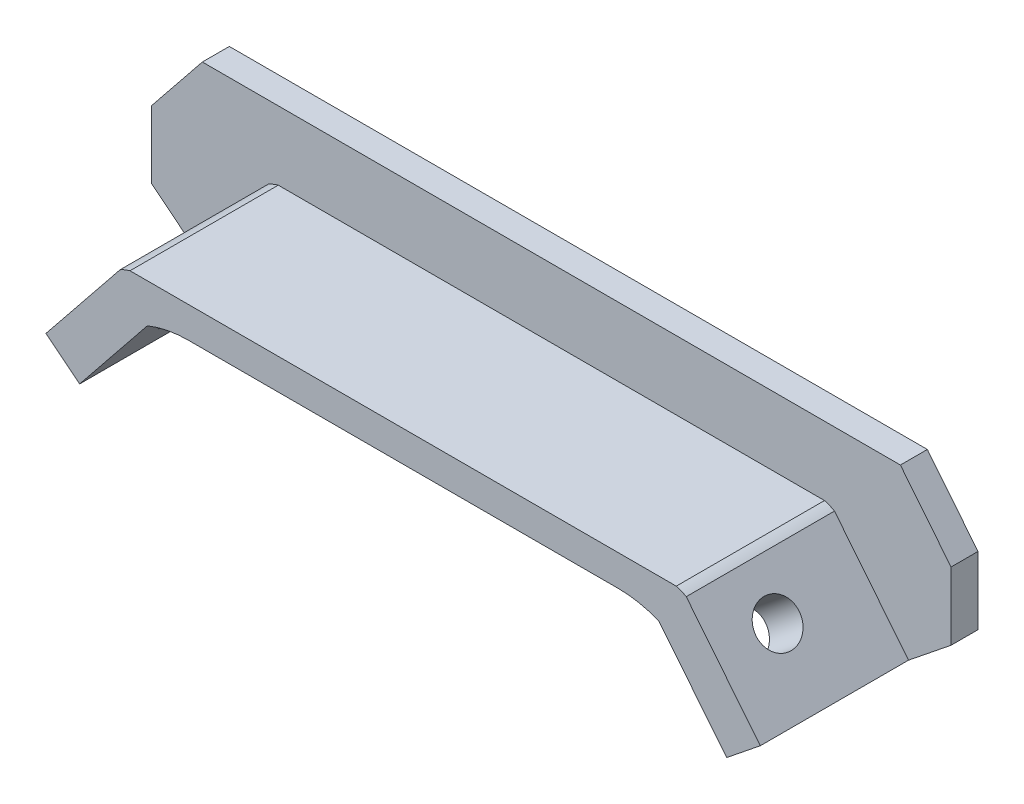
from build123d import *

# Parameters (mm, degrees)
EXTRUDE_5_DEPTH          = 30
EXTRUDE_6_DEPTH          = 2
CUT_EXTRUDE_7_DEPTH      = 10
CUT_EXTRUDE_7_DEPTH_BACK = 10
EXTRUDE_8_DEPTH          = 13
SKETCH_14_R              = 1.6
CUT_EXTRUDE_8_DEPTH      = 10
SKETCH_21_R              = 3.5
CUT_EXTRUDE_10_DEPTH     = 10
FILLET_3_R               = 3
CUT_EXTRUDE_9_DEPTH      = 11
EXTRUDE_7_DEPTH          = 2


with BuildPart() as part:
    # 草图1<3> → 凸台-拉伸5 (new body)
    with BuildSketch(Plane.XY):
        with BuildLine():
            Line((-20.937049459, 94.3), (-26.657578158, 87.182553786))
            Line((-26.657578158, 87.182553786), (-24.786904599, 85.67903111))
            Line((-24.786904599, 85.67903111), (-22.188666929, 88.911742253))
            ThreePointArc((-22.188666929, 88.911742253), (-19.410403975, 91.114358531), (-15.9530884, 91.9))
            Line((-15.9530884, 91.9), (15.9530884, 91.9))
            ThreePointArc((15.9530884, 91.9), (19.410403975, 91.114358531), (22.188666929, 88.911742253))
            Line((22.188666929, 88.911742253), (24.786904599, 85.67903111))
            Line((24.786904599, 85.67903111), (26.657578158, 87.182553786))
            Line((26.657578158, 87.182553786), (20.937049459, 94.3))
            Line((20.937049459, 94.3), (-20.937049459, 94.3))
        make_face()
    extrude(amount=EXTRUDE_5_DEPTH)

    # 草图12 → 凸台-拉伸6 (add)
    with BuildSketch(Plane(origin=(0, 0, 0), x_dir=(-1, 0, 0), z_dir=(0, 0, -1))):
        Polygon((20.937049459, 94.3), (26.657578158, 87.182553786), (26.657578158, 95.163810199), (23.333184583, 99.3), (-23.333184583, 99.3), (-26.657578158, 95.163810199), (-26.657578158, 87.182553786), (-20.937049459, 94.3), align=None)
    extrude(amount=-EXTRUDE_6_DEPTH)

    # 草图13 → 切除-拉伸7 (cut, two sides: drawn at the far end of the back side and taken through both)
    with BuildSketch(Plane.XZ.offset(-91.9).offset(-CUT_EXTRUDE_7_DEPTH_BACK)):
        Polygon((-15.9530884, 13), (15.9530884, 13), (26.657578158, 13), (26.657578158, 30), (-26.657578158, 30), (-26.657578158, 13), align=None)
    extrude(amount=CUT_EXTRUDE_7_DEPTH + CUT_EXTRUDE_7_DEPTH_BACK, mode=Mode.SUBTRACT)

    # 草图20 → 凸台-拉伸8 (add)
    with BuildSketch(Plane.XY.offset(13)):
        Polygon((-24.786904599, 85.67903111), (-19.762367643, 91.930528728), (-18.982920327, 91.304060946), (-24.007457283, 85.052563329), align=None)
    extrude_8 = extrude(amount=-EXTRUDE_8_DEPTH)

    # 草图14 → 切除-拉伸8 (cut, symmetric)
    with BuildSketch(Plane(origin=(-56.116495667, 45.102697556, 0), x_dir=(0, 0, -1), z_dir=(0.7794473160570586, -0.6264677816866944, 0))):
        with Locations(Location((-8.5, 56.385494975, 0), (0, 0, 90))):
            Circle(SKETCH_14_R)
    cut_extrude_8 = extrude(amount=CUT_EXTRUDE_8_DEPTH, both=True, mode=Mode.SUBTRACT)

    # 草图21 → 切除-拉伸10 (cut)
    with BuildSketch(Plane(origin=(-56.116495667, 45.102697556, 0), x_dir=(0, 0, -1), z_dir=(0.7794473160570586, -0.6264677816866944, 0))):
        with Locations((-8.5, 56.385494975)):
            Circle(SKETCH_21_R)
    cut_extrude_10 = extrude(amount=CUT_EXTRUDE_10_DEPTH, mode=Mode.SUBTRACT)

    # 镜向2: 凸台-拉伸8, 切除-拉伸8, 切除-拉伸10 across plane
    add(extrude_8.mirror(Plane(origin=(0, 0, 0), x_dir=(0, 0, 1), z_dir=(1, 0, 0))))
    add(cut_extrude_8.mirror(Plane(origin=(0, 0, 0), x_dir=(0, 0, 1), z_dir=(1, 0, 0))), mode=Mode.SUBTRACT)
    add(cut_extrude_10.mirror(Plane(origin=(0, 0, 0), x_dir=(0, 0, 1), z_dir=(1, 0, 0))), mode=Mode.SUBTRACT)

    # 圆角3
    fillet_3_edges = [part.edges().sort_by_distance(p)[0] for p in [
        (-20.937049459, 94.3, 7.5),
        (20.937049459, 94.3, 7.5),
    ]]
    fillet(fillet_3_edges, radius=FILLET_3_R)

    # 草图15 → 切除-拉伸9 (cut)
    with BuildSketch(Plane.XY.offset(13)):
        with BuildLine():
            ThreePointArc((21.837710333, 93.179403345), (21.455277133, 93.574735362), (21.007094419, 93.89360024))
            Line((21.007094419, 93.89360024), (26.501688695, 87.05726023))
            Line((26.501688695, 87.05726023), (26.657578158, 87.182553786))
            Line((26.657578158, 87.182553786), (21.837710333, 93.179403345))
        make_face()
        with BuildLine():
            Line((-26.657578158, 87.182553786), (-26.501688695, 87.05726023))
            Line((-26.501688695, 87.05726023), (-21.007094419, 93.89360024))
            ThreePointArc((-21.007094419, 93.89360024), (-21.455277133, 93.574735362), (-21.837710333, 93.179403345))
            Line((-21.837710333, 93.179403345), (-26.657578158, 87.182553786))
        make_face()
        with BuildLine():
            ThreePointArc((-19.499368384, 94.3), (-19.886666719, 94.274894956), (-20.267482959, 94.2))
            Line((-20.267482959, 94.2), (20.267482959, 94.2))
            ThreePointArc((20.267482959, 94.2), (19.886666719, 94.274894956), (19.499368384, 94.3))
            Line((19.499368384, 94.3), (-19.499368384, 94.3))
        make_face()
    extrude(amount=-CUT_EXTRUDE_9_DEPTH, mode=Mode.SUBTRACT)

    # 草图17 → 凸台-拉伸7 (add)
    with BuildSketch(Plane.XY.offset(2)):
        Polygon((-29.657578158, 89.593753756), (-26.657578158, 87.182553786), (-26.657578158, 95.163810199), (-23.333184583, 99.3), (-25.89910528, 99.3), (-29.657578158, 94.62373143), align=None)
        Polygon((23.333184583, 99.3), (26.657578158, 95.163810199), (26.657578158, 87.182553786), (29.657578158, 89.593753756), (29.657578158, 94.62373143), (25.89910528, 99.3), align=None)
    extrude(amount=-EXTRUDE_7_DEPTH)


solid = part.part
